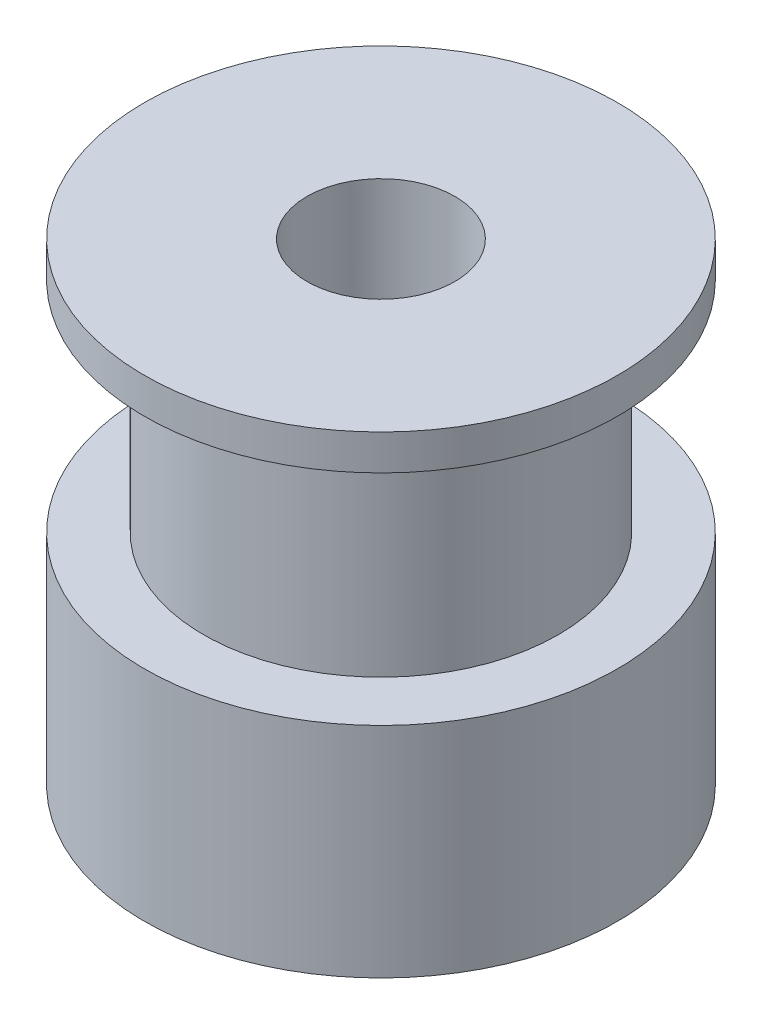
from build123d import *

# Parameters (mm, degrees)
CUT_EXTRUDE1_REACH      = 21.596
SKETCH2_R               = 2.5
CUT_EXTRUDE2_REACH      = 17.78
CUT_EXTRUDE2_END_RADIUS = 8
SKETCH3_R               = 2
CIRPATTERN1_COUNT       = 2
CIRPATTERN1_ANGLE       = 90


with BuildPart() as part:
    # Sketch1 → Revolve1 (revolve)
    with BuildSketch(Plane.XY):
        Polygon((0, 5), (-8, 5), (-8, 3.8), (-6, 3.8), (-6, -3.6), (-8, -3.6), (-8, -11), (0, -11), align=None)
    revolve(axis=Axis((0, 1004.776363636, 0), (0, -1, 0)))

    # Sketch2 → Cut-Extrude1 (cut, up to next)
    with BuildSketch(Plane(origin=(0, 5, 0), x_dir=(1, 0, 0), z_dir=(0, 1, 0)), mode=Mode.PRIVATE) as cut_extrude1_sk1:
        with Locations(Location((0, 0, 0), (0, 0, 180))):
            Circle(SKETCH2_R)
    cut_extrude1_tool1 = extrude(cut_extrude1_sk1.sketch, amount=-CUT_EXTRUDE1_REACH, mode=Mode.PRIVATE) & part.part
    add(cut_extrude1_tool1.solids().sort_by_distance((0, 5, 0))[0], mode=Mode.SUBTRACT)

    # Cut-Extrude2: up to this cylinder (the profile starts inside it)
    cut_extrude2_end = Plane(origin=(0, -7.3, 0), z_dir=(0, 1, 0)) * Cylinder(CUT_EXTRUDE2_END_RADIUS, 52.56, mode=Mode.PRIVATE)
    # Sketch3 → Cut-Extrude2 (cut, up to the surface)
    with BuildSketch(Plane.XY, mode=Mode.PRIVATE) as cut_extrude2_sk1:
        with Locations((0, -7.3)):
            Circle(SKETCH3_R)
    cut_extrude2_tool1 = extrude(cut_extrude2_sk1.sketch, amount=-CUT_EXTRUDE2_REACH, mode=Mode.PRIVATE) & cut_extrude2_end
    cut_extrude2 = cut_extrude2_tool1.solids().sort_by_distance((0, -7.3, 0))[0]
    add(cut_extrude2, mode=Mode.SUBTRACT)

    # CirPattern1: Cut-Extrude2 ×2 about axis
    cirpattern1_axis = Axis((0, -11, 0), (0, 1, 0))
    for i in range(1, CIRPATTERN1_COUNT):
        add(cut_extrude2.rotate(cirpattern1_axis, i * CIRPATTERN1_ANGLE / (CIRPATTERN1_COUNT - 1)), mode=Mode.SUBTRACT)


solid = part.part
